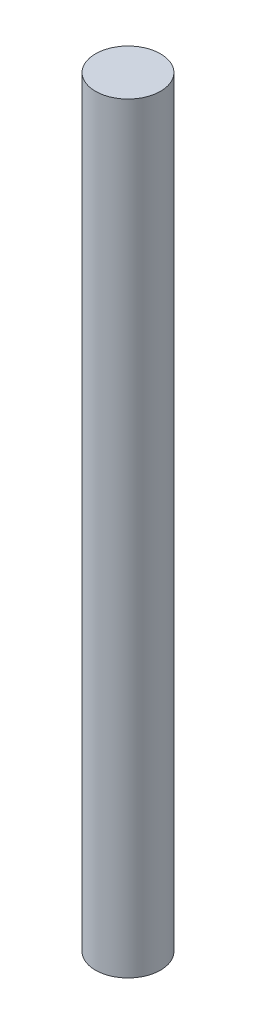
from build123d import *

# Parameters (mm, degrees)
SKETCH1_R           = 0.5207
BOSS_EXTRUDE1_DEPTH = 6.096


with BuildPart() as part:
    # Sketch1 → Boss-Extrude1 (new, symmetric)
    with BuildSketch(Plane(origin=(0, 0, 0), x_dir=(1, 0, 0), z_dir=(0, 1, 0))):
        with Locations(Location((0, 0, 0), (0, 0, 270))):
            Circle(SKETCH1_R)
    extrude(amount=BOSS_EXTRUDE1_DEPTH, both=True)


solid = part.part
